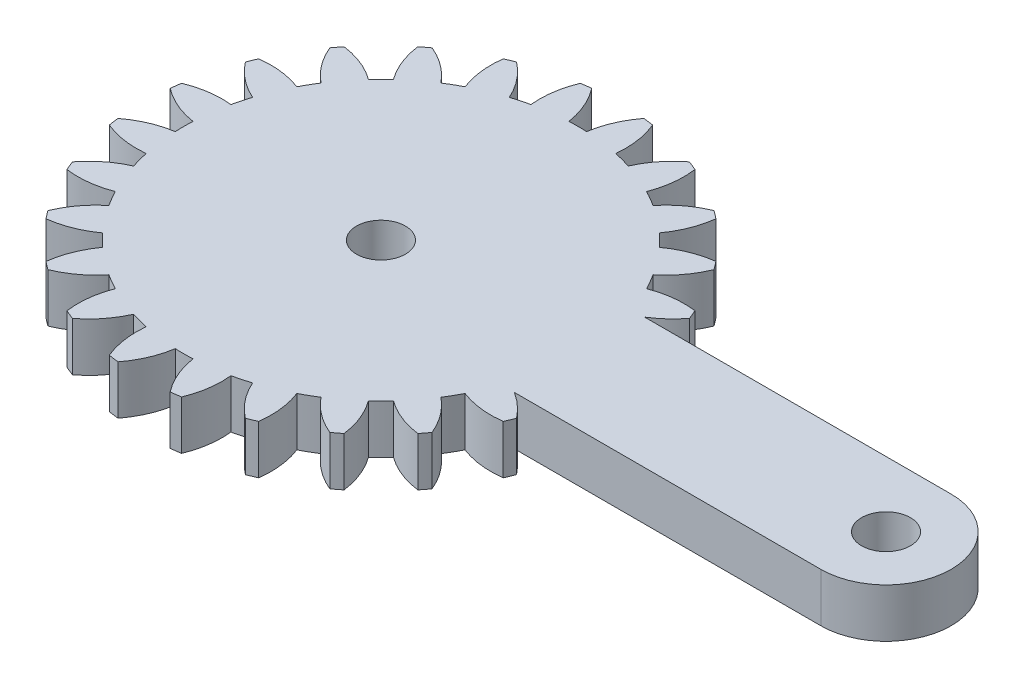
from build123d import *

# Parameters (mm, degrees)
SKETCH1_R           = 1.5
BOSS_EXTRUDE1_DEPTH = 1.5


with BuildPart() as part:
    # Sketch1 → Boss-Extrude1 (new, symmetric)
    with BuildSketch(Plane(origin=(0, 0, 0), x_dir=(1, 0, 0), z_dir=(0, 1, 0))):
        with BuildLine():
            Line((11.067960149, -3.770386358), (29.879975659, -3.770386358))
            ThreePointArc((29.879975659, -3.770386358), (33.879975659, 0.229613642), (29.879975659, 4.229613642))
            Line((29.879975659, 4.229613642), (11.067960149, 4.229613642))
            ThreePointArc((11.067960149, 4.229613642), (11.847346546, 4.817815376), (12.508067649, 5.536753523))
            ThreePointArc((12.508067649, 5.536753523), (12.391713822, 5.826358841), (12.269206518, 6.113415305))
            ThreePointArc((12.269206518, 6.113415305), (10.921594192, 6.123653667), (9.613413173, 5.799884882))
            ThreePointArc((9.613413173, 5.799884882), (9.35260436, 6.275988642), (9.070690816, 6.73990758))
            ThreePointArc((9.070690816, 6.73990758), (10.005173318, 7.710941183), (10.670112799, 8.883126872))
            ThreePointArc((10.670112799, 8.883126872), (10.482768261, 9.132749542), (10.290139612, 9.378317571))
            ThreePointArc((10.290139612, 9.378317571), (8.985796179, 9.039419334), (7.805987876, 8.38810054))
            ThreePointArc((7.805987876, 8.38810054), (7.430841187, 8.780479171), (7.038462557, 9.155625859))
            ThreePointArc((7.038462557, 9.155625859), (7.68978135, 10.335434163), (8.028679587, 11.639777595))
            ThreePointArc((8.028679587, 11.639777595), (7.783111558, 11.832406244), (7.533488888, 12.019750783))
            ThreePointArc((7.533488888, 12.019750783), (6.361303199, 11.354811301), (5.390269597, 10.420328799))
            ThreePointArc((5.390269597, 10.420328799), (4.926350659, 10.702242344), (4.450246898, 10.963051157))
            ThreePointArc((4.450246898, 10.963051157), (4.774015684, 12.271232176), (4.763777322, 13.618844501))
            ThreePointArc((4.763777322, 13.618844501), (4.476720857, 13.741351805), (4.187115539, 13.857705633))
            ThreePointArc((4.187115539, 13.857705633), (3.22697011, 12.912039434), (2.530885544, 11.758076661))
            ThreePointArc((2.530885544, 11.758076661), (2.009809666, 11.910313178), (1.48242646, 12.039010426))
            ThreePointArc((1.48242646, 12.039010426), (1.45658093, 13.386413785), (1.097903696, 14.685457451))
            ThreePointArc((1.097903696, 14.685457451), (0.78892122, 14.72949474), (0.479069377, 14.766928535))
            ThreePointArc((0.479069377, 14.766928535), (-0.203603467, 13.604981207), (-0.577301983, 12.31017882))
            ThreePointArc((-0.577301983, 12.31017882), (-1.120024341, 12.322363642), (-1.662746699, 12.31017882))
            ThreePointArc((-1.662746699, 12.31017882), (-2.036445216, 13.604981207), (-2.71911806, 14.766928535))
            ThreePointArc((-2.71911806, 14.766928535), (-3.028969902, 14.72949474), (-3.337952378, 14.685457451))
            ThreePointArc((-3.337952378, 14.685457451), (-3.696629612, 13.386413785), (-3.722475143, 12.039010426))
            ThreePointArc((-3.722475143, 12.039010426), (-4.249858349, 11.910313178), (-4.770934227, 11.758076661))
            ThreePointArc((-4.770934227, 11.758076661), (-5.467018792, 12.912039434), (-6.427164221, 13.857705633))
            ThreePointArc((-6.427164221, 13.857705633), (-6.71676954, 13.741351805), (-7.003826004, 13.618844501))
            ThreePointArc((-7.003826004, 13.618844501), (-7.014064366, 12.271232176), (-6.690295581, 10.963051157))
            ThreePointArc((-6.690295581, 10.963051157), (-7.166399341, 10.702242344), (-7.630318279, 10.420328799))
            ThreePointArc((-7.630318279, 10.420328799), (-8.601351881, 11.354811301), (-9.773537571, 12.019750783))
            ThreePointArc((-9.773537571, 12.019750783), (-10.02316024, 11.832406244), (-10.26872827, 11.639777595))
            ThreePointArc((-10.26872827, 11.639777595), (-9.929830033, 10.335434163), (-9.278511239, 9.155625859))
            ThreePointArc((-9.278511239, 9.155625859), (-9.670889869, 8.780479171), (-10.046036558, 8.38810054))
            ThreePointArc((-10.046036558, 8.38810054), (-11.225844862, 9.039419334), (-12.530188294, 9.378317571))
            ThreePointArc((-12.530188294, 9.378317571), (-12.722816943, 9.132749542), (-12.910161481, 8.883126872))
            ThreePointArc((-12.910161481, 8.883126872), (-12.245222, 7.710941183), (-11.310739498, 6.73990758))
            ThreePointArc((-11.310739498, 6.73990758), (-11.592653043, 6.275988642), (-11.853461856, 5.799884882))
            ThreePointArc((-11.853461856, 5.799884882), (-13.161642874, 6.123653667), (-14.5092552, 6.113415305))
            ThreePointArc((-14.5092552, 6.113415305), (-14.631762504, 5.826358841), (-14.748116331, 5.536753523))
            ThreePointArc((-14.748116331, 5.536753523), (-13.802450133, 4.576608094), (-12.64848736, 3.880523528))
            ThreePointArc((-12.64848736, 3.880523528), (-12.800723877, 3.35944765), (-12.929421125, 2.832064444))
            ThreePointArc((-12.929421125, 2.832064444), (-14.276824484, 2.806218913), (-15.57586815, 2.44754168))
            ThreePointArc((-15.57586815, 2.44754168), (-15.619905439, 2.138559204), (-15.657339233, 1.828707361))
            ThreePointArc((-15.657339233, 1.828707361), (-14.495391906, 1.146034517), (-13.200589518, 0.772336))
            ThreePointArc((-13.200589518, 0.772336), (-13.212774341, 0.229613642), (-13.200589518, -0.313108715))
            ThreePointArc((-13.200589518, -0.313108715), (-14.495391906, -0.686807232), (-15.657339233, -1.369480076))
            ThreePointArc((-15.657339233, -1.369480076), (-15.619905439, -1.679331919), (-15.57586815, -1.988314395))
            ThreePointArc((-15.57586815, -1.988314395), (-14.276824484, -2.346991628), (-12.929421125, -2.372837159))
            ThreePointArc((-12.929421125, -2.372837159), (-12.800723877, -2.900220365), (-12.64848736, -3.421296243))
            ThreePointArc((-12.64848736, -3.421296243), (-13.802450133, -4.117380809), (-14.748116331, -5.077526238))
            ThreePointArc((-14.748116331, -5.077526238), (-14.631762504, -5.367131556), (-14.5092552, -5.65418802))
            ThreePointArc((-14.5092552, -5.65418802), (-13.161642874, -5.664426382), (-11.853461856, -5.340657597))
            ThreePointArc((-11.853461856, -5.340657597), (-11.592653043, -5.816761358), (-11.310739498, -6.280680295))
            ThreePointArc((-11.310739498, -6.280680295), (-12.245222, -7.251713898), (-12.910161481, -8.423899587))
            ThreePointArc((-12.910161481, -8.423899587), (-12.722816943, -8.673522257), (-12.530188294, -8.919090286))
            ThreePointArc((-12.530188294, -8.919090286), (-11.225844862, -8.580192049), (-10.046036558, -7.928873256))
            ThreePointArc((-10.046036558, -7.928873256), (-9.670889869, -8.321251886), (-9.278511239, -8.696398575))
            ThreePointArc((-9.278511239, -8.696398575), (-9.929830033, -9.876206878), (-10.26872827, -11.18055031))
            ThreePointArc((-10.26872827, -11.18055031), (-10.02316024, -11.373178959), (-9.773537571, -11.560523498))
            ThreePointArc((-9.773537571, -11.560523498), (-8.601351881, -10.895584017), (-7.630318279, -9.961101514))
            ThreePointArc((-7.630318279, -9.961101514), (-7.166399341, -10.243015059), (-6.690295581, -10.503823872))
            ThreePointArc((-6.690295581, -10.503823872), (-7.014064366, -11.812004891), (-7.003826004, -13.159617217))
            ThreePointArc((-7.003826004, -13.159617217), (-6.71676954, -13.282124521), (-6.427164222, -13.398478348))
            ThreePointArc((-6.427164222, -13.398478348), (-5.467018793, -12.452812149), (-4.770934227, -11.298849376))
            ThreePointArc((-4.770934227, -11.298849376), (-4.249858349, -11.451085894), (-3.722475143, -11.579783141))
            ThreePointArc((-3.722475143, -11.579783141), (-3.696629612, -12.9271865), (-3.337952379, -14.226230166))
            ThreePointArc((-3.337952379, -14.226230166), (-3.028969902, -14.270267455), (-2.71911806, -14.30770125))
            ThreePointArc((-2.71911806, -14.30770125), (-2.036445216, -13.145753923), (-1.662746699, -11.850951535))
            ThreePointArc((-1.662746699, -11.850951535), (-1.120024341, -11.863136358), (-0.577301983, -11.850951535))
            ThreePointArc((-0.577301983, -11.850951535), (-0.203603467, -13.145753923), (0.479069377, -14.30770125))
            ThreePointArc((0.479069377, -14.30770125), (0.78892122, -14.270267455), (1.097903696, -14.226230166))
            ThreePointArc((1.097903696, -14.226230166), (1.45658093, -12.9271865), (1.48242646, -11.579783141))
            ThreePointArc((1.48242646, -11.579783141), (2.009809666, -11.451085893), (2.530885544, -11.298849376))
            ThreePointArc((2.530885544, -11.298849376), (3.22697011, -12.452812149), (4.187115539, -13.398478348))
            ThreePointArc((4.187115539, -13.398478348), (4.476720857, -13.282124521), (4.763777322, -13.159617216))
            ThreePointArc((4.763777322, -13.159617216), (4.774015684, -11.812004891), (4.450246898, -10.503823872))
            ThreePointArc((4.450246898, -10.503823872), (4.926350659, -10.243015059), (5.390269597, -9.961101514))
            ThreePointArc((5.390269597, -9.961101514), (6.361303199, -10.895584017), (7.533488888, -11.560523498))
            ThreePointArc((7.533488888, -11.560523498), (7.783111558, -11.373178959), (8.028679587, -11.18055031))
            ThreePointArc((8.028679587, -11.18055031), (7.68978135, -9.876206878), (7.038462557, -8.696398575))
            ThreePointArc((7.038462557, -8.696398575), (7.430841187, -8.321251886), (7.805987876, -7.928873256))
            ThreePointArc((7.805987876, -7.928873256), (8.985796179, -8.580192049), (10.290139612, -8.919090286))
            ThreePointArc((10.290139612, -8.919090286), (10.482768261, -8.673522257), (10.670112799, -8.423899587))
            ThreePointArc((10.670112799, -8.423899587), (10.005173318, -7.251713898), (9.070690816, -6.280680295))
            ThreePointArc((9.070690816, -6.280680295), (9.35260436, -5.816761358), (9.613413173, -5.340657597))
            ThreePointArc((9.613413173, -5.340657597), (10.921594192, -5.664426382), (12.269206518, -5.65418802))
            ThreePointArc((12.269206518, -5.65418802), (12.391713822, -5.367131556), (12.508067649, -5.077526238))
            ThreePointArc((12.508067649, -5.077526238), (11.847346546, -4.358588091), (11.067960149, -3.770386358))
        make_face()
        with Locations(Location((29.879975659, 0.229613642, 0), (0, 0, 270))):
            Circle(SKETCH1_R, mode=Mode.SUBTRACT)
        with Locations(Location((-1.120024341, 0.229613642, 0), (0, 0, 270))):
            Circle(SKETCH1_R, mode=Mode.SUBTRACT)
    extrude(amount=BOSS_EXTRUDE1_DEPTH, both=True)


solid = part.part
